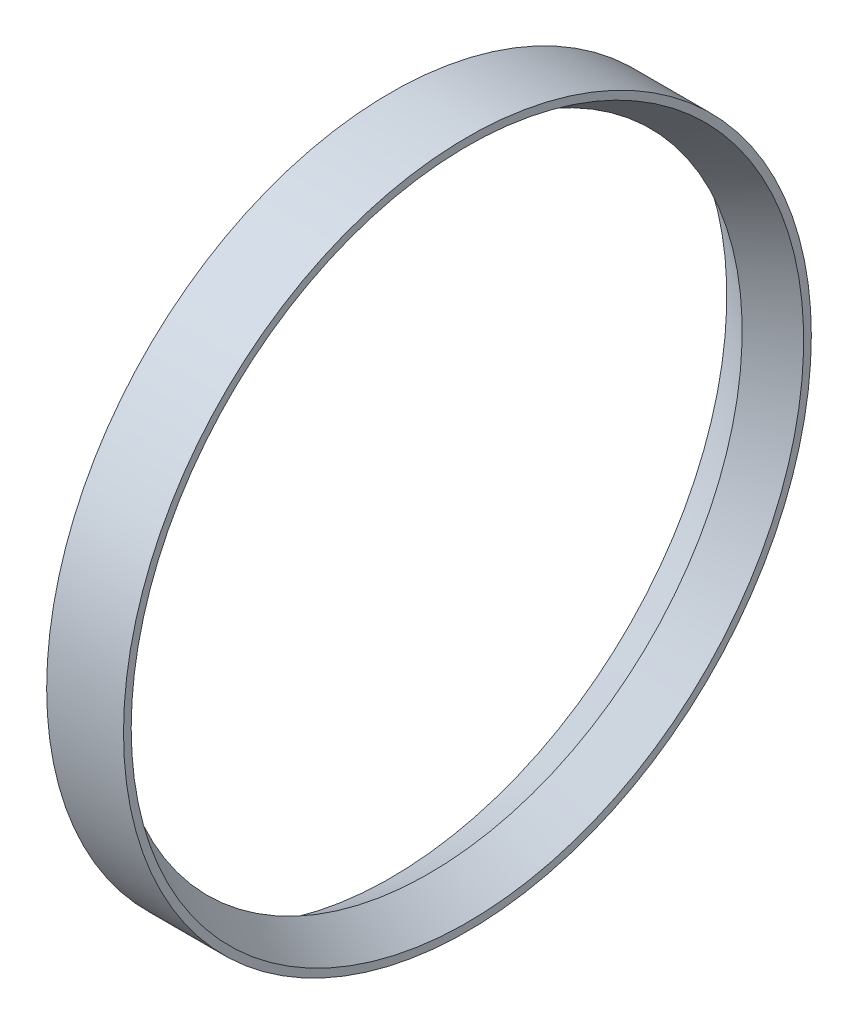
from build123d import *


with BuildPart() as part:
    # Sketch2 → Revolve1 (revolve)
    with BuildSketch(Plane(origin=(0, 0, 0), x_dir=(1, 0, 0), z_dir=(0, 1, 0))):
        Polygon((4, -35), (0, -32.6), (-4, -35), (-4, -35.8), (4, -35.8), align=None)
    revolve(axis=Axis((0, 0, 0), (1, 0, 0)))


solid = part.part
